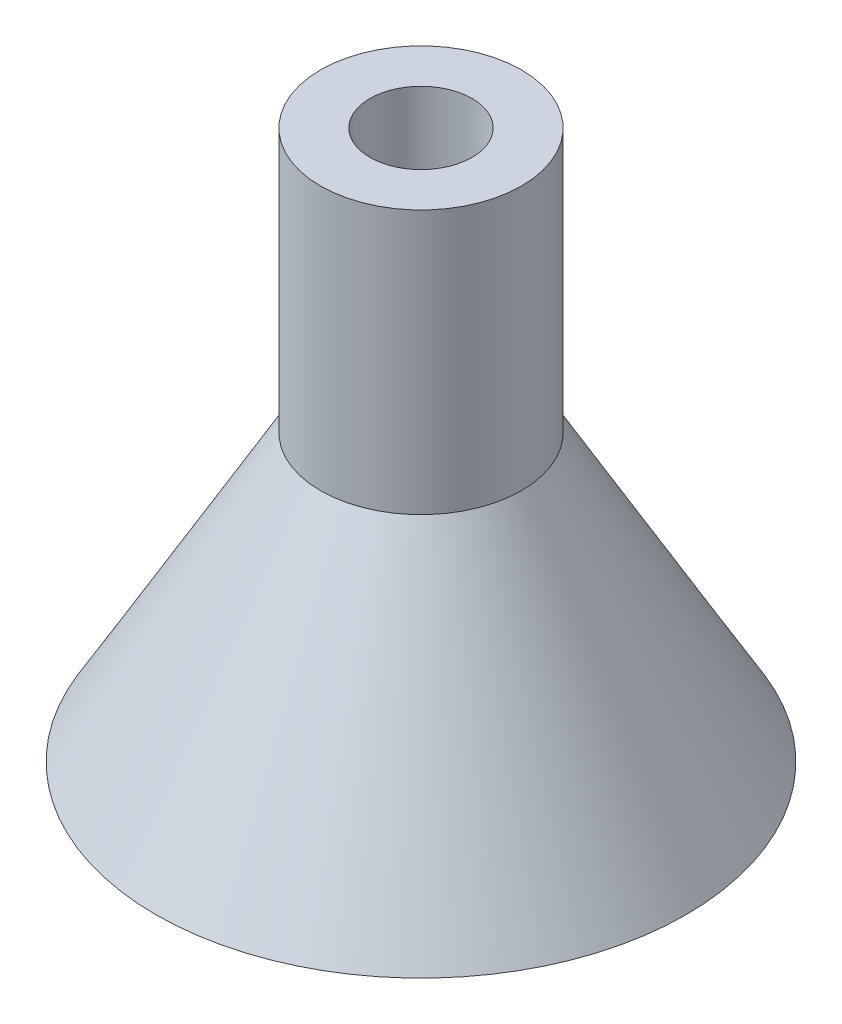
from build123d import *


with BuildPart() as part:
    # Sketch2 → Revolve1 (revolve)
    with BuildSketch(Plane.XY, mode=Mode.PRIVATE) as revolve1_sk:
        Polygon((13.072300245, 0), (16.074521645, 0), (6.096, 17.283306474), (6.096, 33.283306474), (3.096, 33.283306474), (3.096, 17.279458897), align=None)
    revolve(revolve1_sk.sketch.rotate(Axis((0, 0, 0), (0, 1, 0)), 90), axis=Axis((0, 0, 0), (0, 1, 0)))


solid = part.part
